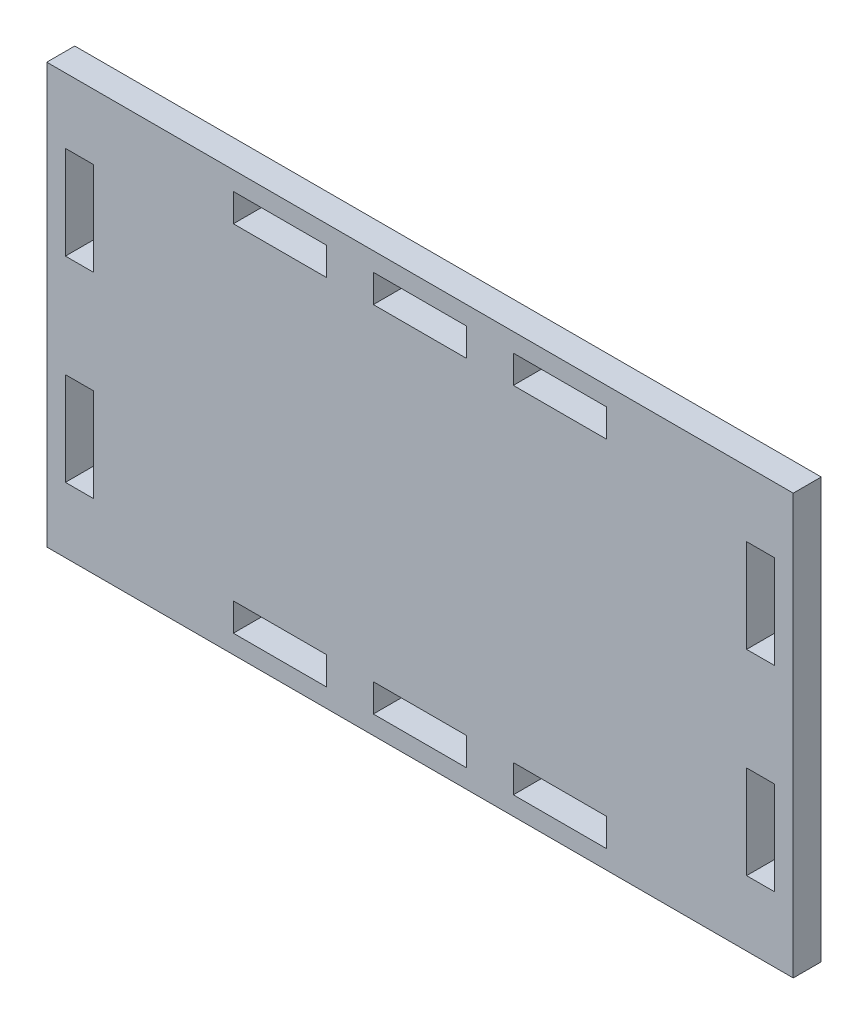
from build123d import *

# Parameters (mm, degrees)
SKETCH_1_W      = 80
SKETCH_1_H      = 45
SKETCH_1_W_2    = 10
SKETCH_1_H_2    = 3
SKETCH_1_W_3    = 3
SKETCH_1_H_3    = 10
EXTRUDE_1_DEPTH = 3


with BuildPart() as part:
    # 草图1 → 凸台-拉伸1 (new body)
    with BuildSketch(Plane.XY):
        Rectangle(SKETCH_1_W, SKETCH_1_H)
        with Locations((0, 19)):
            Rectangle(SKETCH_1_W_2, SKETCH_1_H_2, mode=Mode.SUBTRACT)
        with Locations((-15, 19)):
            Rectangle(SKETCH_1_W_2, SKETCH_1_H_2, mode=Mode.SUBTRACT)
        with Locations((-36.5, 10.5)):
            Rectangle(SKETCH_1_W_3, SKETCH_1_H_3, mode=Mode.SUBTRACT)
        with Locations((15, 19)):
            Rectangle(SKETCH_1_W_2, SKETCH_1_H_2, mode=Mode.SUBTRACT)
        with Locations((15, -19)):
            Rectangle(SKETCH_1_W_2, SKETCH_1_H_2, mode=Mode.SUBTRACT)
        with Locations((0, -19)):
            Rectangle(SKETCH_1_W_2, SKETCH_1_H_2, mode=Mode.SUBTRACT)
        with Locations((-15, -19)):
            Rectangle(SKETCH_1_W_2, SKETCH_1_H_2, mode=Mode.SUBTRACT)
        with Locations((-36.5, -10.5)):
            Rectangle(SKETCH_1_W_3, SKETCH_1_H_3, mode=Mode.SUBTRACT)
        with Locations((36.5, -10.5)):
            Rectangle(SKETCH_1_W_3, SKETCH_1_H_3, mode=Mode.SUBTRACT)
        with Locations((36.5, 10.5)):
            Rectangle(SKETCH_1_W_3, SKETCH_1_H_3, mode=Mode.SUBTRACT)
    extrude(amount=EXTRUDE_1_DEPTH)


solid = part.part
